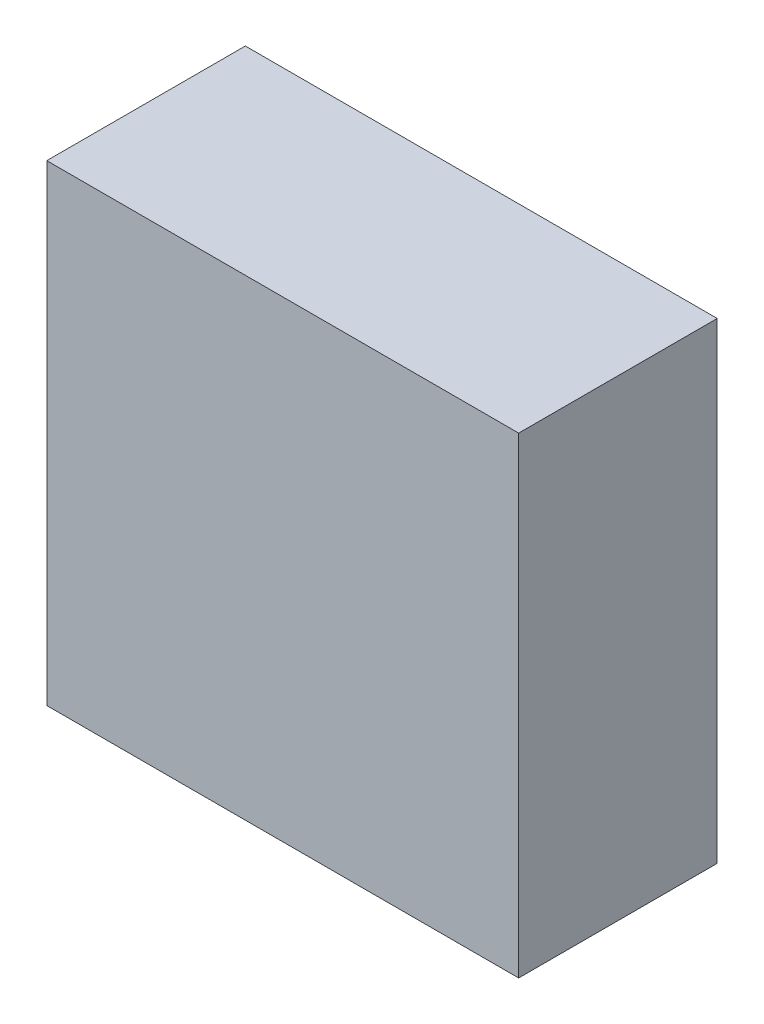
from build123d import *

# Parameters (mm, degrees)
SKETCH1_W           = 20.2
SKETCH1_H           = 20.2
BOSS_EXTRUDE1_DEPTH = 8.5


with BuildPart() as part:
    # Sketch1 → Boss-Extrude1 (new body)
    with BuildSketch(Plane.XY):
        Rectangle(SKETCH1_W, SKETCH1_H)
    extrude(amount=BOSS_EXTRUDE1_DEPTH)


solid = part.part
